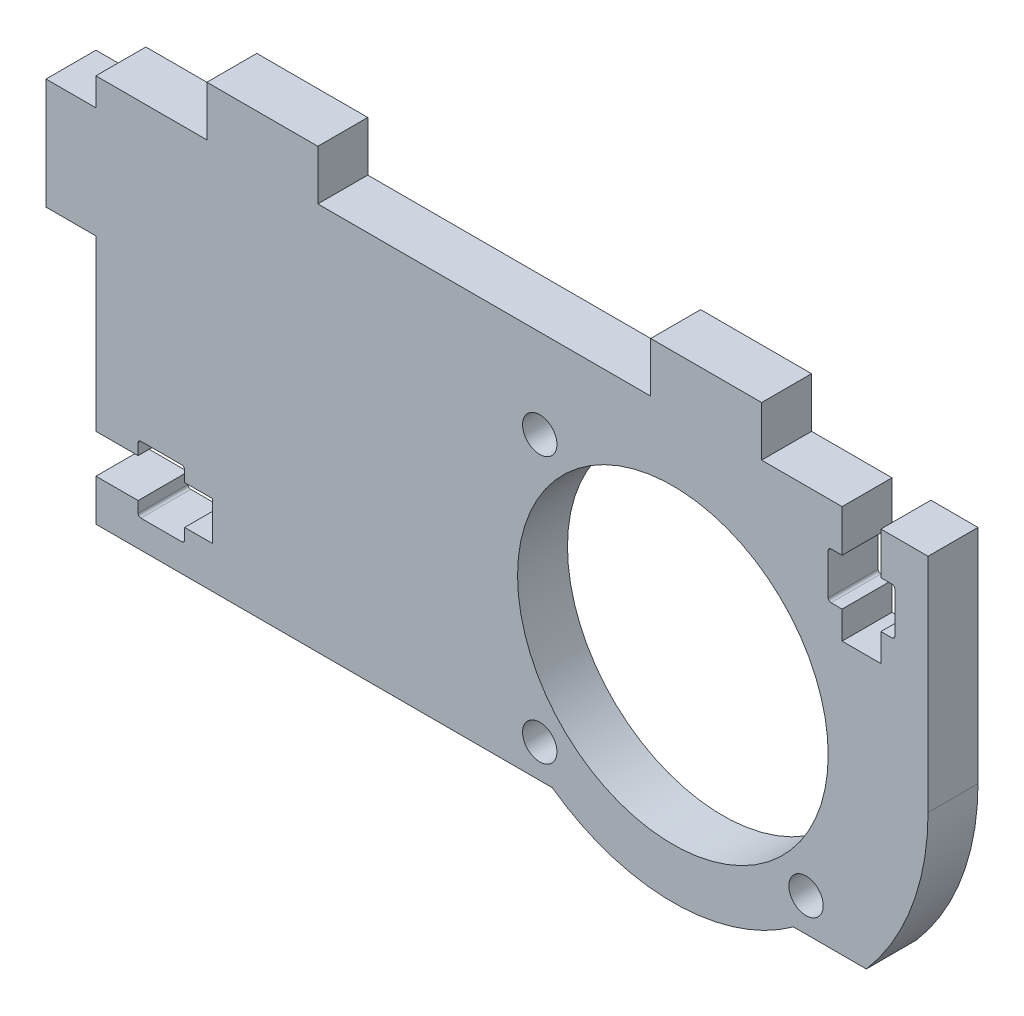
from build123d import *

# Parameters (mm, degrees)
SKETCH1_W           = 75
SKETCH1_H           = 35
MAINSHAPE_DEPTH     = 4.5
SKETCH2_W           = 4.5
SKETCH2_H           = 10
REARTAB_DEPTH       = 4.5
SKETCH3_W           = 10
SKETCH3_H           = 4.5
BOSS_EXTRUDE3_DEPTH = 4.5
CUT_EXTRUDE1_DEPTH  = 83.886971232
SKETCH6_R           = 14
SKETCH6_R_2         = 1.55
CUT_EXTRUDE3_DEPTH  = 83.886971232
BOSS_EXTRUDE4_DEPTH = 4.5
CUT_EXTRUDE7_DEPTH  = 85.433901689
SMOOTHEDGE_DEPTH    = 85.433901689


with BuildPart() as part:
    # Sketch1 → MainShape (new body)
    with BuildSketch(Plane.XY):
        with Locations((37.5, -17.5)):
            Rectangle(SKETCH1_W, SKETCH1_H)
    extrude(amount=MAINSHAPE_DEPTH)

    # Sketch2 → RearTab (add, through all)
    with BuildSketch(Plane.XY.offset(4.5)):
        with Locations((-2.25, -7.5)):
            Rectangle(SKETCH2_W, SKETCH2_H)
    extrude(amount=-REARTAB_DEPTH)

    # Sketch3 → Boss-Extrude3 (add, through all)
    with BuildSketch(Plane.XY.offset(4.5)):
        with Locations((15, 2.25)):
            Rectangle(SKETCH3_W, SKETCH3_H)
        with Locations((55, 2.25)):
            Rectangle(SKETCH3_W, SKETCH3_H)
    extrude(amount=-BOSS_EXTRUDE3_DEPTH)

    # Sketch4 → Cut-Extrude1 (cut, through all)
    with BuildSketch(Plane.XY.offset(4.5)):
        with BuildLine():
            Line((67.25, 0), (67.25, -3.8))
            Line((67.25, -3.8), (66.25, -3.8))
            ThreePointArc((66.25, -3.8), (66.073223305, -3.873223305), (66, -4.05))
            Line((66, -4.05), (66, -7.75))
            ThreePointArc((66, -7.75), (66.073223305, -7.926776695), (66.25, -8))
            Line((66.25, -8), (67.25, -8))
            Line((67.25, -8), (67.25, -10.5))
            Line((67.25, -10.5), (70.75, -10.5))
            Line((70.75, -10.5), (70.75, -8))
            Line((70.75, -8), (71.75, -8))
            ThreePointArc((71.75, -8), (71.926776695, -7.926776695), (72, -7.75))
            Line((72, -7.75), (72, -4.05))
            ThreePointArc((72, -4.05), (71.926776695, -3.873223305), (71.75, -3.8))
            Line((71.75, -3.8), (70.75, -3.8))
            Line((70.75, -3.8), (70.75, 0))
            Line((70.75, 0), (67.25, 0))
        make_face()
    extrude(amount=-CUT_EXTRUDE1_DEPTH, mode=Mode.SUBTRACT)

    # Sketch6 → Cut-Extrude3 (cut, through all)
    with BuildSketch(Plane.XY.offset(4.5)):
        with Locations((52, -20)):
            Circle(SKETCH6_R)
        with Locations((40, -8)):
            Circle(SKETCH6_R_2)
        with Locations((64, -32)):
            Circle(SKETCH6_R_2)
        with Locations((40, -32)):
            Circle(SKETCH6_R_2)
    extrude(amount=-CUT_EXTRUDE3_DEPTH, mode=Mode.SUBTRACT)

    # Sketch7 → Boss-Extrude4 (add, through all)
    with BuildSketch(Plane.XY.offset(4.5)):
        with BuildLine():
            Line((62.86329805, -35), (41.13670195, -35))
            ThreePointArc((41.13670195, -35), (52, -38.520562748), (62.86329805, -35))
        make_face()
    extrude(amount=-BOSS_EXTRUDE4_DEPTH)

    # Sketch11 → Cut-Extrude7 (cut, through all)
    with BuildSketch(Plane.XY.offset(4.5)):
        with BuildLine():
            Line((0, -31.25), (0, -27.75))
            Line((0, -27.75), (3.8, -27.75))
            Line((3.8, -27.75), (3.8, -26.75))
            ThreePointArc((3.8, -26.75), (3.873223305, -26.573223305), (4.05, -26.5))
            Line((4.05, -26.5), (7.75, -26.5))
            ThreePointArc((7.75, -26.5), (7.926776695, -26.573223305), (8, -26.75))
            Line((8, -26.75), (8, -27.75))
            Line((8, -27.75), (10.5, -27.75))
            Line((10.5, -27.75), (10.5, -31.25))
            Line((10.5, -31.25), (8, -31.25))
            Line((8, -31.25), (8, -32.25))
            ThreePointArc((8, -32.25), (7.926776695, -32.426776695), (7.75, -32.5))
            Line((7.75, -32.5), (4.05, -32.5))
            ThreePointArc((4.05, -32.5), (3.873223305, -32.426776695), (3.8, -32.25))
            Line((3.8, -32.25), (3.8, -31.25))
            Line((3.8, -31.25), (0, -31.25))
        make_face()
    extrude(amount=-CUT_EXTRUDE7_DEPTH, mode=Mode.SUBTRACT)

    # Sketch14 → SmoothEdge (cut, through all)
    with BuildSketch(Plane.XY.offset(4.5)):
        with BuildLine():
            Line((69.435595774, -35), (75, -35))
            Line((75, -35), (75, -20))
            ThreePointArc((75, -20), (73.564075482, -27.999415516), (69.435595774, -35))
        make_face()
    extrude(amount=-SMOOTHEDGE_DEPTH, mode=Mode.SUBTRACT)


solid = part.part
